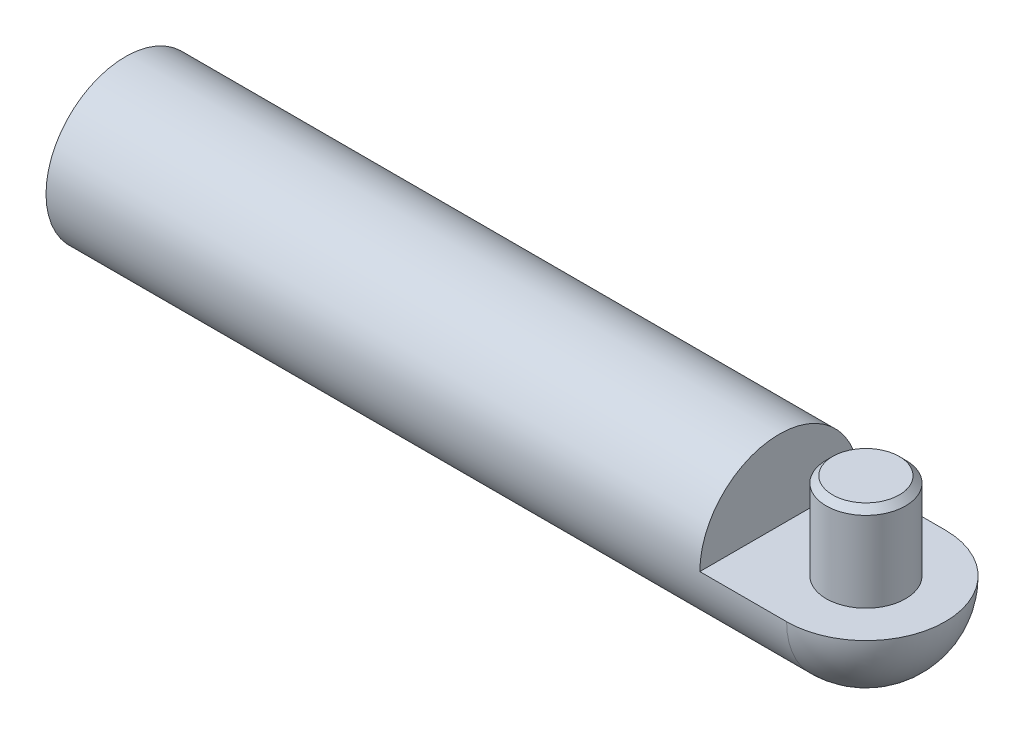
from build123d import *

# Parameters (mm, degrees)
REVOLVE3_ANGLE      = 90
SKETCH18_R          = 19.05
BOSS_EXTRUDE5_DEPTH = 177.8
CUT_EXTRUDE4_DEPTH  = 20.828
SKETCH21_R          = 9.525
BOSS_EXTRUDE6_DEPTH = 20.828
CHAMFER2_SIZE       = 1.524


with BuildPart() as part:
    # Sketch17 → Revolve3 (revolve)
    with BuildSketch(Plane(origin=(0, 0, 0), x_dir=(0, 0, -1), z_dir=(1, 0, 0))):
        with BuildLine():
            Line((19.05, 0), (-19.05, 0))
            ThreePointArc((-19.05, 0), (0, -19.05), (19.05, 0))
        make_face()
    revolve(axis=Axis((0, 0, -19.05), (0, 0, 1)), revolution_arc=REVOLVE3_ANGLE)

    # Sketch18 → Boss-Extrude5 (add)
    with BuildSketch(Plane.ZY):
        Circle(SKETCH18_R)
    extrude(amount=BOSS_EXTRUDE5_DEPTH)

    # Sketch20 → Cut-Extrude4 (cut)
    with BuildSketch(Plane(origin=(0, 0, 0), x_dir=(0, 0, -1), z_dir=(1, 0, 0))):
        with BuildLine():
            Line((-19.05, 0), (19.05, 0))
            ThreePointArc((19.05, 0), (0, 19.05), (-19.05, 0))
        make_face()
    extrude(amount=-CUT_EXTRUDE4_DEPTH, mode=Mode.SUBTRACT)

    # Sketch21 → Boss-Extrude6 (add)
    with BuildSketch(Plane(origin=(0, 0, 0), x_dir=(1, 0, 0), z_dir=(0, 1, 0))):
        with Locations(Location((0, 0, 0), (0, 0, 180))):
            Circle(SKETCH21_R)
    extrude(amount=BOSS_EXTRUDE6_DEPTH)

    # Chamfer2
    chamfer2_edges = [part.edges().sort_by_distance(p)[0] for p in [
        (9.525, 20.828, 0),
    ]]
    chamfer(chamfer2_edges, length=CHAMFER2_SIZE)


solid = part.part
